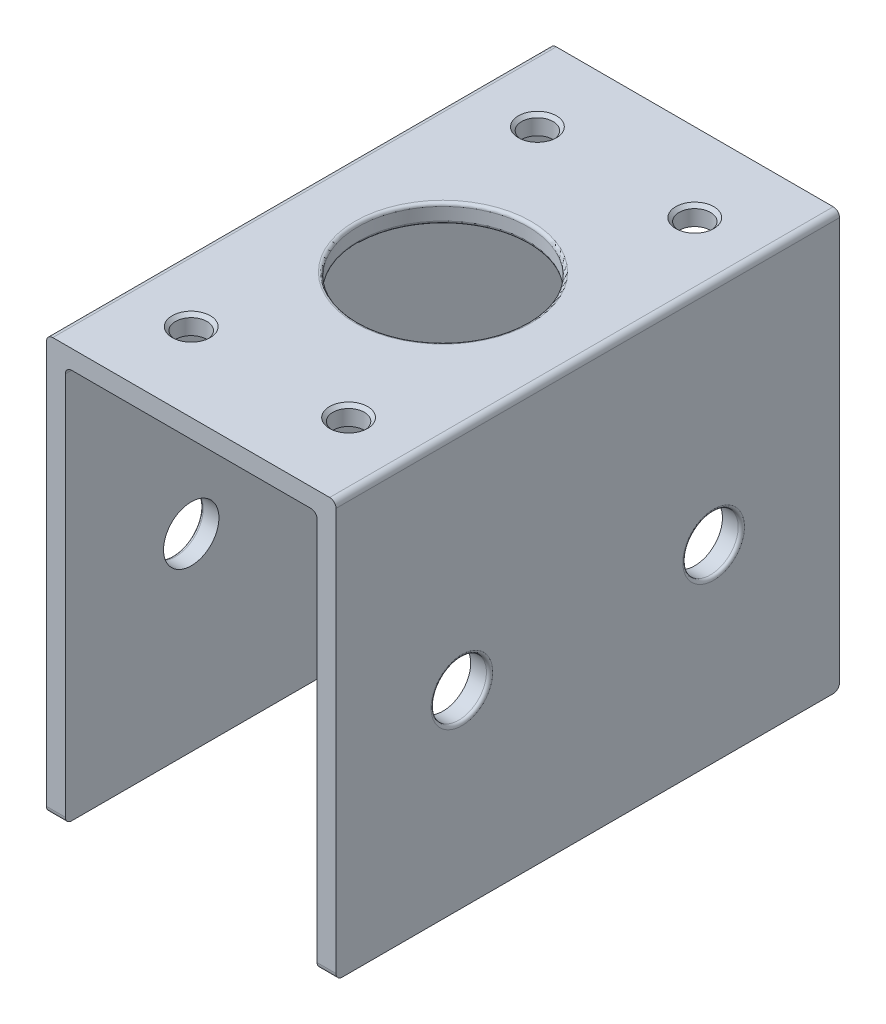
from build123d import *

# Parameters (mm, degrees)
EXTRUDE_1_DEPTH              = 80
HOLE_WIZARD_M6_1_D           = 5
HOLE_WIZARD_M6_1_CSINK_D     = 6.05
HOLE_WIZARD_M6_1_CSINK_ANGLE = 90
CUT_EXTRUDE_1_DEPTH          = 70
SKETCH_6_R                   = 4.4
CUT_EXTRUDE_2_DEPTH          = 112.736296699
FILLET_1_R                   = 1
FILLET_2_R                   = 0.5


with BuildPart() as part:
    # 草图1 → 凸台-拉伸1 (new body)
    with BuildSketch(Plane.XY):
        Polygon((0, 0), (40, 0), (40, -63), (43, -63), (43, 3), (-3, 3), (-3, -63), (0, -63), align=None)
    extrude(amount=EXTRUDE_1_DEPTH)

    # M6 螺纹孔1 (through all)
    with Locations(Plane(origin=(0, 3, 0), x_dir=(1, 0, 0), z_dir=(0, 1, 0))):
        with Locations((7.5, -12.5), (32.5, -12.5), (32.5, -67.5), (7.5, -67.5)):
            CounterSinkHole(HOLE_WIZARD_M6_1_D / 2, HOLE_WIZARD_M6_1_CSINK_D / 2, counter_sink_angle=HOLE_WIZARD_M6_1_CSINK_ANGLE)

    # 草图5 → 切除-拉伸1 (cut)
    with BuildSketch(Plane(origin=(0, 3, 0), x_dir=(1, 0, 0), z_dir=(0, 1, 0))):
        with BuildLine():
            ThreePointArc((6.5, -40), (20, -53.5), (33.5, -40))
            Line((33.5, -40), (6.5, -40))
        make_face()
        with BuildLine():
            Line((6.5, -40), (33.5, -40))
            ThreePointArc((33.5, -40), (20, -26.5), (6.5, -40))
        make_face()
    extrude(amount=-CUT_EXTRUDE_1_DEPTH, mode=Mode.SUBTRACT)

    # 草图6 → 切除-拉伸2 (cut, through all)
    with BuildSketch(Plane(origin=(43, 0, 0), x_dir=(0, 0, -1), z_dir=(1, 0, 0))):
        with Locations((-20, -33)):
            Circle(SKETCH_6_R)
        with Locations((-60, -33)):
            Circle(SKETCH_6_R)
    extrude(amount=-CUT_EXTRUDE_2_DEPTH, mode=Mode.SUBTRACT)

    # 圆角1
    fillet_1_edges = [part.edges().sort_by_distance(p)[0] for p in [
        (41.5, -63, 0),
        (-3, 3, 40),
        (43, 3, 40),
        (40, 0, 40),
        (0, 0, 40),
        (41.5, -63, 80),
        (-1.5, -63, 80),
        (-1.5, -63, 0),
    ]]
    fillet(fillet_1_edges, radius=FILLET_1_R)

    # 圆角2
    fillet_2_edges = [part.edges().sort_by_distance(p)[0] for p in [
        (33.5, 0, 40),
        (33.5, 3, 40),
        (43, -33, 64.4),
        (-3, -33, 64.4),
        (-3, -33, 24.4),
        (43, -33, 24.4),
    ]]
    fillet(fillet_2_edges, radius=FILLET_2_R)


solid = part.part
